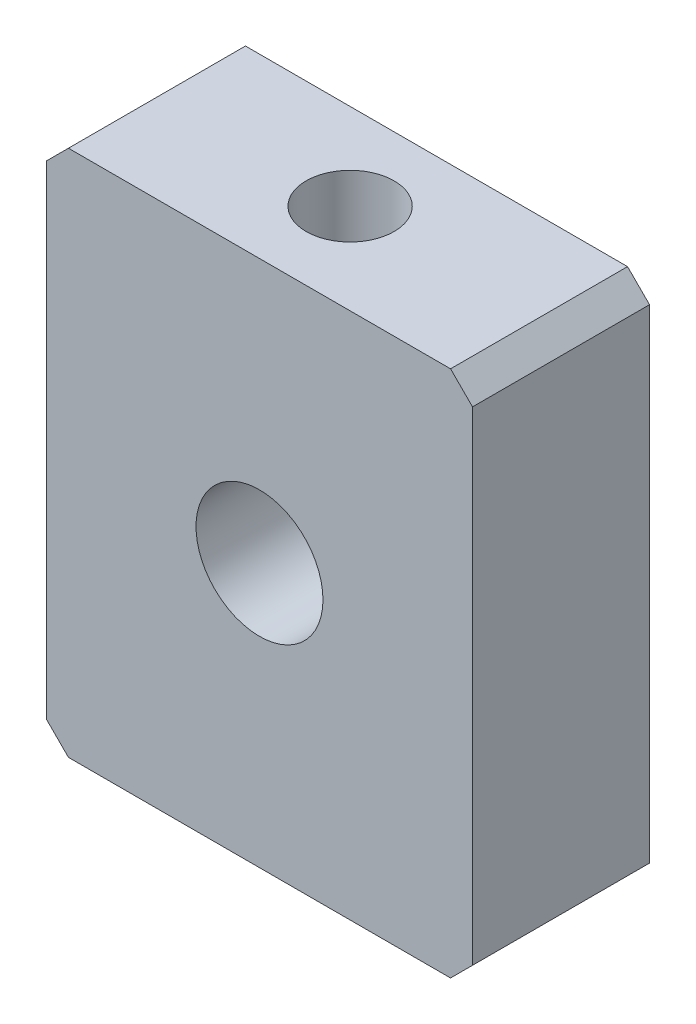
from build123d import *

# Parameters (mm, degrees)
SKETCH_1_W          = 96.91
SKETCH_1_H          = 120
SKETCH_1_R          = 14.438127561
EXTRUDE_2_DEPTH     = 40.26
CHAMFER_1_SIZE      = 5
SKETCH_2_R          = 10
CUT_EXTRUDE_1_DEPTH = 20


with BuildPart() as part:
    # 草图1 → 凸台-拉伸2 (new body)
    with BuildSketch(Plane.XY.offset(-85)):
        with Locations((-359.756516484, 622.442102346)):
            Rectangle(SKETCH_1_W, SKETCH_1_H)
        with Locations((-359.756516484, 622.442102346)):
            Circle(SKETCH_1_R, mode=Mode.SUBTRACT)
    extrude(amount=-EXTRUDE_2_DEPTH)

    # 倒角1
    chamfer_1_edges = [part.edges().sort_by_distance(p)[0] for p in [
        (-311.301516484, 682.442102346, -105.13),
        (-311.301516484, 562.442102346, -105.13),
        (-408.211516484, 562.442102346, -105.13),
        (-408.211516484, 682.442102346, -105.13),
    ]]
    chamfer(chamfer_1_edges, length=CHAMFER_1_SIZE)

    # 草图2 → 切除-拉伸1 (cut)
    with BuildSketch(Plane(origin=(0, 682.442102346, 0), x_dir=(1, 0, 0), z_dir=(0, 1, 0))):
        with Locations(Location((-359.756516484, 105.61, 0), (0, 0, 270))):
            Circle(SKETCH_2_R)
    extrude(amount=-CUT_EXTRUDE_1_DEPTH, mode=Mode.SUBTRACT)


solid = part.part
